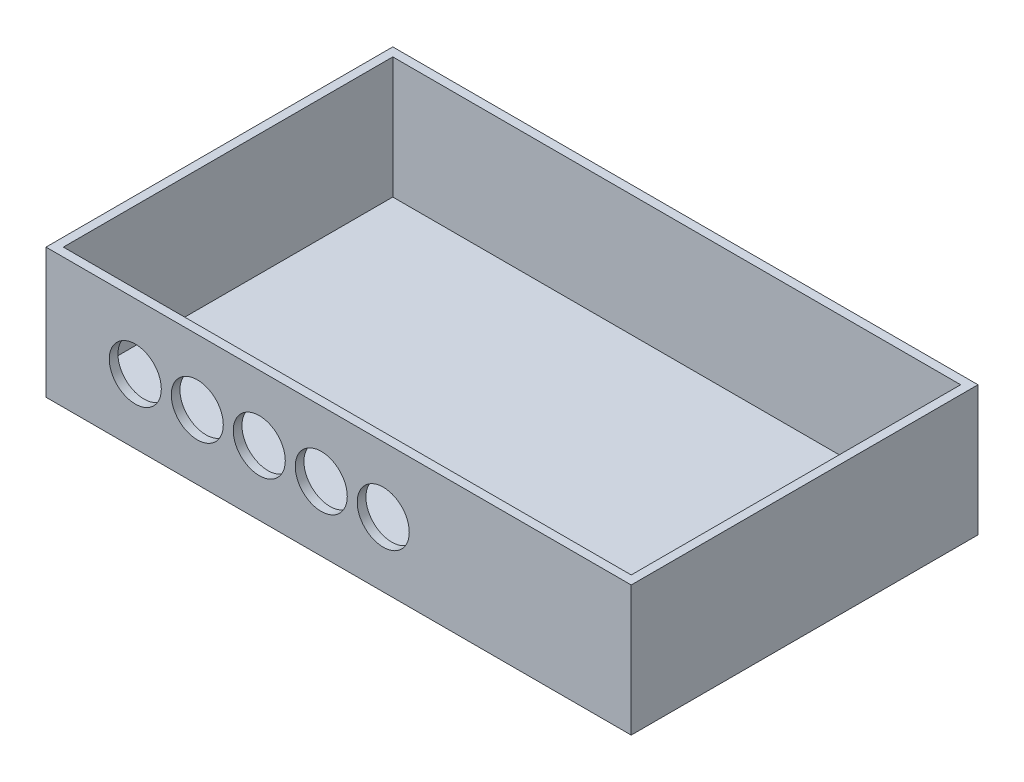
from build123d import *

# Parameters (mm, degrees)
SKIZZE1_W                       = 135
SKIZZE1_H                       = 80
AUFSATZ_LINEAR_AUSTRAGEN1_DEPTH = 30
SCHALE1_T                       = -2
SKIZZE2_R                       = 6
SCHNITT_LINEAR_AUSTRAGEN1_DEPTH = 30


with BuildPart() as part:
    # Skizze1 → Aufsatz-Linear austragen1 (new body)
    with BuildSketch(Plane(origin=(0, 0, 0), x_dir=(1, 0, 0), z_dir=(0, 1, 0))):
        with Locations((67.5, 40)):
            Rectangle(SKIZZE1_W, SKIZZE1_H)
    extrude(amount=AUFSATZ_LINEAR_AUSTRAGEN1_DEPTH)

    # Schale1
    schale1_openings = [part.faces().sort_by_distance(p)[0] for p in [
        (67.5, 30, -40),
    ]]
    offset(amount=SCHALE1_T, openings=schale1_openings, kind=Kind.INTERSECTION)

    # Skizze2 → Schnitt-Linear austragen1 (cut)
    with BuildSketch(Plane.XY):
        with Locations((20.6, 14.94)):
            Circle(SKIZZE2_R)
        with Locations((34.9, 14.94)):
            Circle(SKIZZE2_R)
        with Locations((49.2, 14.94)):
            Circle(SKIZZE2_R)
        with Locations((63.5, 14.94)):
            Circle(SKIZZE2_R)
        with Locations((77.8, 14.94)):
            Circle(SKIZZE2_R)
    extrude(amount=-SCHNITT_LINEAR_AUSTRAGEN1_DEPTH, mode=Mode.SUBTRACT)


solid = part.part
